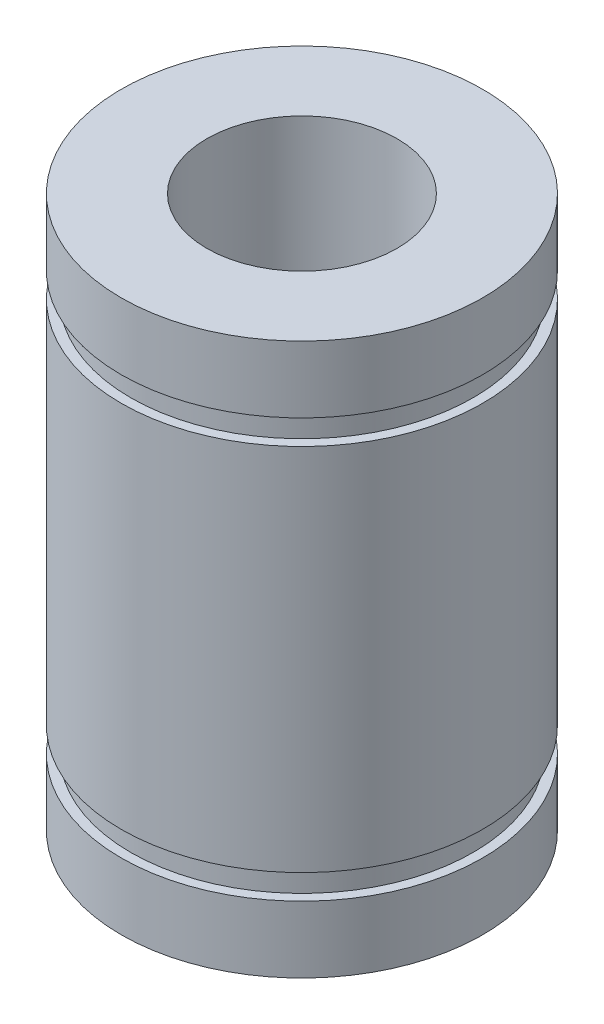
from build123d import *


with BuildPart() as part:
    # Sketch1 → Revolve1 (revolve)
    with BuildSketch(Plane.XY, mode=Mode.PRIVATE) as revolve1_sk:
        Polygon((5, 14.5), (9.5, 14.5), (9.5, 11), (9, 11), (9, 9.7), (9.5, 9.7), (9.5, -9.7), (9, -9.7), (9, -11), (9.5, -11), (9.5, -14.5), (5, -14.5), align=None)
    revolve(revolve1_sk.sketch.rotate(Axis((0, 46.044618834, 0), (0, -1, 0)), 90), axis=Axis((0, 46.044618834, 0), (0, -1, 0)))


solid = part.part
